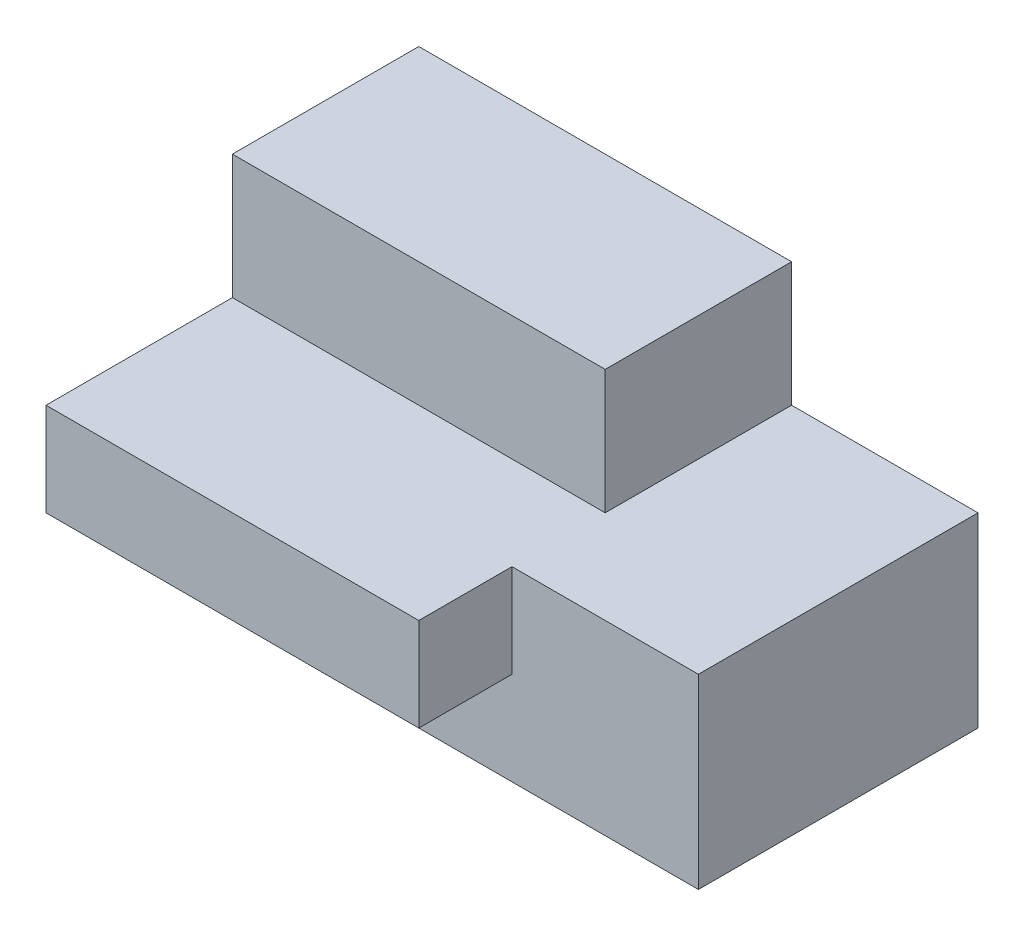
from build123d import *

# Parameters (mm, degrees)
SKETCH1_W           = 72
SKETCH1_H           = 24
BOSS_EXTRUDE1_DEPTH = 36
SKETCH1_3_W         = 48
SKETCH1_3_H         = 12
BOSS_EXTRUDE2_DEPTH = 12
BOSS_EXTRUDE4_START = -12
SKETCH1_5_W         = 48
SKETCH1_5_H         = 16
BOSS_EXTRUDE4_DEPTH = 24


with BuildPart() as part:
    # Sketch1 → Boss-Extrude1 (new body)
    with BuildSketch(Plane.XY):
        with Locations((36, 12)):
            Rectangle(SKETCH1_W, SKETCH1_H)
    extrude(amount=-BOSS_EXTRUDE1_DEPTH)

    # Sketch1<3> → Boss-Extrude2 (add)
    with BuildSketch(Plane.XY):
        with Locations((24, 18)):
            Rectangle(SKETCH1_3_W, SKETCH1_3_H)
    extrude(amount=BOSS_EXTRUDE2_DEPTH)

    # Sketch1<5> → Boss-Extrude4 (add)
    with BuildSketch(Plane.XY.offset(BOSS_EXTRUDE4_START)):
        with Locations((24, 32)):
            Rectangle(SKETCH1_5_W, SKETCH1_5_H)
    extrude(amount=-BOSS_EXTRUDE4_DEPTH)


solid = part.part
